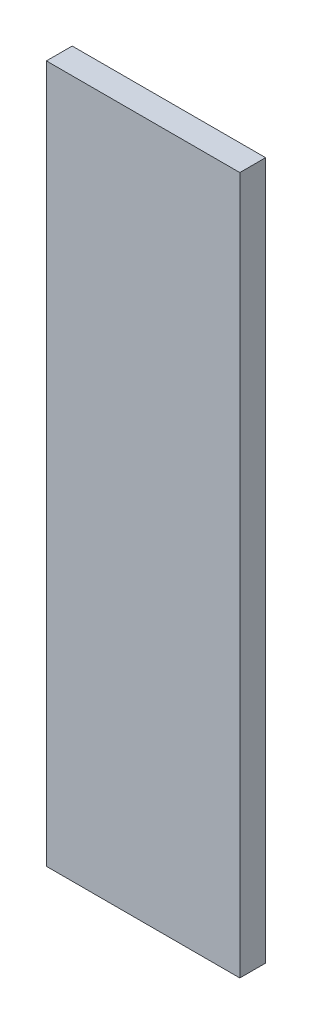
from build123d import *

# Parameters (mm, degrees)
SKETCH_1_W      = 15
SKETCH_1_H      = 54.1
EXTRUDE_1_DEPTH = 2


with BuildPart() as part:
    # Эскиз1 → Бобышка-Вытянуть1 (new body)
    with BuildSketch(Plane.XY):
        with Locations((7.5, 27.05)):
            Rectangle(SKETCH_1_W, SKETCH_1_H)
    extrude(amount=EXTRUDE_1_DEPTH)


solid = part.part
